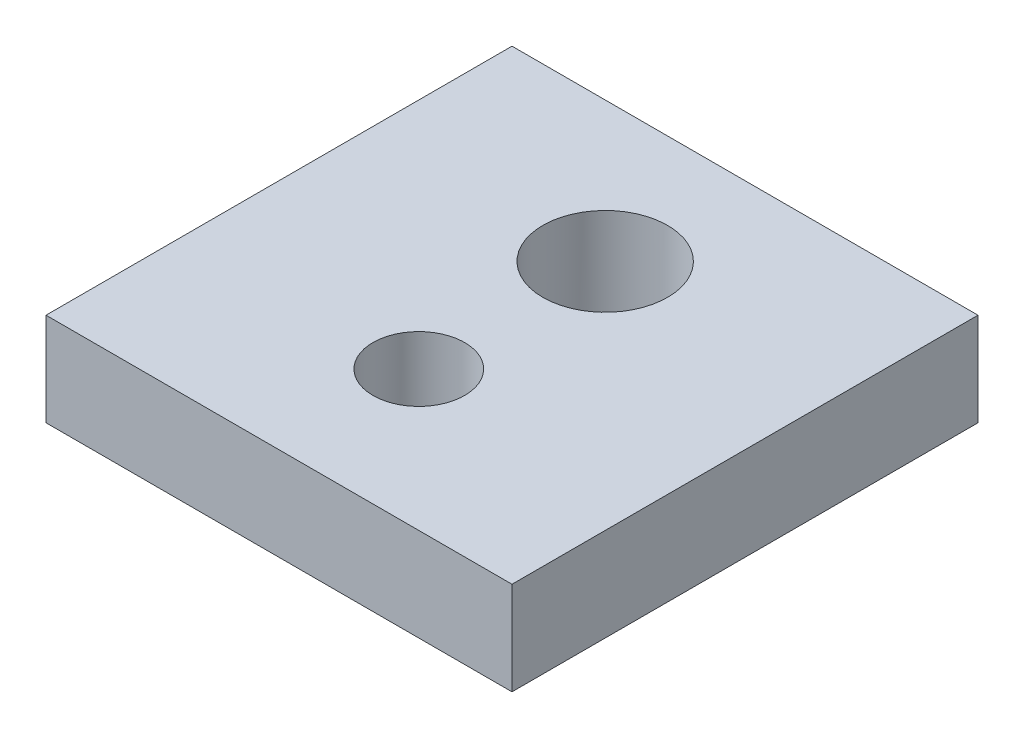
from build123d import *

# Parameters (mm, degrees)
SKETCH1_W                   = 12.7
SKETCH1_H                   = 12.7
BOSS_EXTRUDE1_DEPTH         = 2.54
M3_CLEARANCE_HOLE1_D        = 3.4
TAP_DRILL_FOR_M3X0_5_TAP1_D = 2.5


with BuildPart() as part:
    # Sketch1 → Boss-Extrude1 (new body)
    with BuildSketch(Plane(origin=(0, 0, 0), x_dir=(1, 0, 0), z_dir=(0, 1, 0))):
        Rectangle(SKETCH1_W, SKETCH1_H)
    extrude(amount=BOSS_EXTRUDE1_DEPTH)

    # M3 Clearance Hole1 (through all)
    with Locations(Plane(origin=(0, 2.54, -2.54), x_dir=(0, 0, 1), z_dir=(0, 1, 0))):
        with Locations((0, 0)):
            Hole(M3_CLEARANCE_HOLE1_D / 2)

    # Tap Drill for M3x0.5 Tap1 (through all)
    with Locations(Plane(origin=(0, 2.54, 2.54), x_dir=(0, 0, 1), z_dir=(0, 1, 0))):
        with Locations((0, 0)):
            Hole(TAP_DRILL_FOR_M3X0_5_TAP1_D / 2)


solid = part.part
